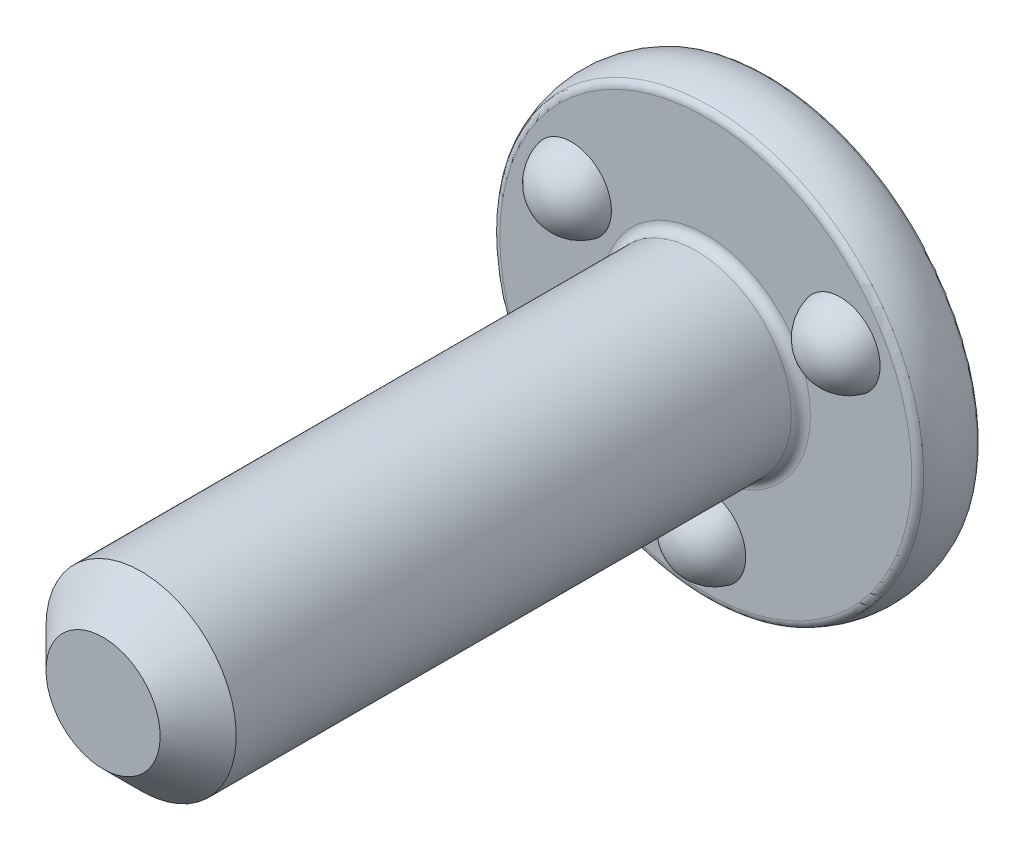
from build123d import *

# Parameters (mm, degrees)
CIRPATTERN1_COUNT = 3


with BuildPart() as part:
    # Sketch2 → Revolve1 (revolve)
    with BuildSketch(Plane(origin=(0, 0, 0), x_dir=(0, 0, -1), z_dir=(1, 0, 0))):
        with BuildLine():
            Line((9.0043, 3.4925), (9.0043, 6.87397239))
            ThreePointArc((9.0043, 6.87397239), (9.047344167, 7.018310977), (9.162415, 7.115497042))
            ThreePointArc((9.162415, 7.115497042), (10.0584, 7.3025), (10.954385, 7.115497042))
            ThreePointArc((10.954385, 7.115497042), (11.069455833, 7.018310977), (11.1125, 6.87397239))
            Line((11.1125, 6.87397239), (11.1125, 0))
            Line((11.1125, 0), (-11.1125, 0))
            Line((-11.1125, 0), (-11.1125, 1.905))
            Line((-11.1125, 1.905), (-9.8425, 3.175))
            Line((-9.8425, 3.175), (8.6868, 3.175))
            ThreePointArc((8.6868, 3.175), (8.911306403, 3.267993597), (9.0043, 3.4925))
        make_face()
    revolve(axis=Axis((0, 0, -11.1125), (0, 0, 1)))

    # Sketch4 → Revolve2 (revolve)
    with BuildSketch(Plane(origin=(0, 0, 0), x_dir=(0, 0, -1), z_dir=(1, 0, 0))):
        with BuildLine():
            Line((9.0043, -6.511925), (9.0043, -5.178425))
            Line((9.0043, -5.178425), (7.9375, -5.178425))
            ThreePointArc((7.9375, -5.178425), (8.237016729, -6.032281617), (9.0043, -6.511925))
        make_face()
    revolve2 = revolve(axis=Axis((0, -5.178425, -9.0043), (0, 0, 1)))

    # CirPattern1: Revolve2 ×3 about axis
    cirpattern1_axis = Axis((0, 0, -11.1125), (0, 0, 1))
    for i in range(1, CIRPATTERN1_COUNT):
        add(revolve2.rotate(cirpattern1_axis, i * 360 / CIRPATTERN1_COUNT))


solid = part.part
